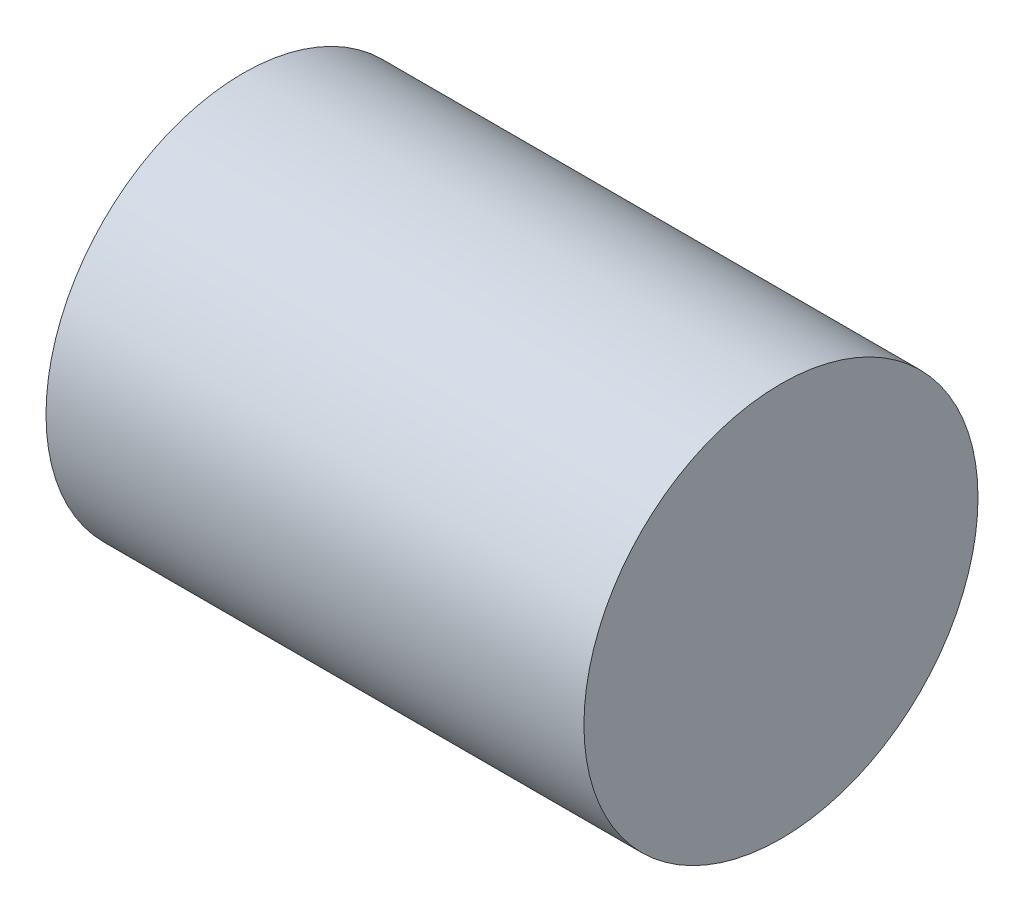
from build123d import *

# Parameters (mm, degrees)
SKETCH1_R           = 16.002
BOSS_EXTRUDE1_DEPTH = 21.844


with BuildPart() as part:
    # Sketch1 → Boss-Extrude1 (new, symmetric)
    with BuildSketch(Plane(origin=(0, 0, 0), x_dir=(0, 0, -1), z_dir=(1, 0, 0))):
        Circle(SKETCH1_R)
    extrude(amount=BOSS_EXTRUDE1_DEPTH, both=True)


solid = part.part
